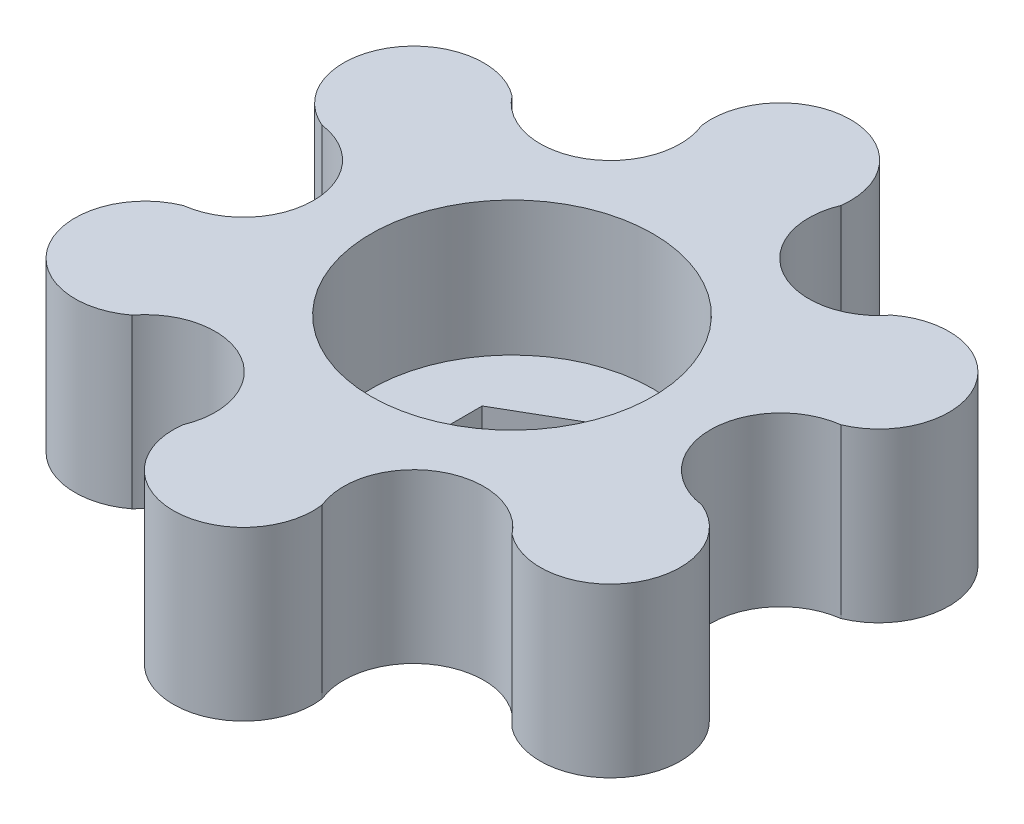
from build123d import *

# Parameters (mm, degrees)
SKETCH1_R           = 4.2
BOSS_EXTRUDE1_DEPTH = 5
SKETCH2_R           = 4.2
BOSS_EXTRUDE2_DEPTH = 1


with BuildPart() as part:
    # Sketch1 → Boss-Extrude1 (new body)
    with BuildSketch(Plane(origin=(0, 0, 0), x_dir=(1, 0, 0), z_dir=(0, 1, 0))):
        with BuildLine():
            ThreePointArc((2.070552361, 7.72740661), (0, 10.088419076), (-2.070552361, 7.72740661))
            ThreePointArc((-2.070552361, 7.72740661), (-2.955790462, 5.119579257), (-5.656854249, 5.656854249))
            ThreePointArc((-5.656854249, 5.656854249), (-8.736827203, 5.044209538), (-7.72740661, 2.070552361))
            ThreePointArc((-7.72740661, 2.070552361), (-5.911580924, 0), (-7.72740661, -2.070552361))
            ThreePointArc((-7.72740661, -2.070552361), (-8.736827203, -5.044209538), (-5.656854249, -5.656854249))
            ThreePointArc((-5.656854249, -5.656854249), (-2.955790462, -5.119579257), (-2.070552361, -7.72740661))
            ThreePointArc((-2.070552361, -7.72740661), (0, -10.088419076), (2.070552361, -7.72740661))
            ThreePointArc((2.070552361, -7.72740661), (2.955790462, -5.119579257), (5.656854249, -5.656854249))
            ThreePointArc((5.656854249, -5.656854249), (8.736827203, -5.044209538), (7.72740661, -2.070552361))
            ThreePointArc((7.72740661, -2.070552361), (5.911580924, 0), (7.72740661, 2.070552361))
            ThreePointArc((7.72740661, 2.070552361), (8.736827203, 5.044209538), (5.656854249, 5.656854249))
            ThreePointArc((5.656854249, 5.656854249), (2.955790462, 5.119579257), (2.070552361, 7.72740661))
        make_face()
        with Locations(Location((0, 0, 0), (0, 0, 270))):
            Circle(SKETCH1_R, mode=Mode.SUBTRACT)
    extrude(amount=BOSS_EXTRUDE1_DEPTH)

    # Sketch2 → Boss-Extrude2 (add)
    with BuildSketch(Plane.XZ):
        with Locations(Location((0, 0, 0), (0, 0, 270))):
            Circle(SKETCH2_R)
        Polygon((0, 2.424871131), (-2.1, 1.212435565), (-2.1, -1.212435565), (0, -2.424871131), (2.1, -1.212435565), (2.1, 1.212435565), align=None, mode=Mode.SUBTRACT)
    extrude(amount=-BOSS_EXTRUDE2_DEPTH)


solid = part.part
